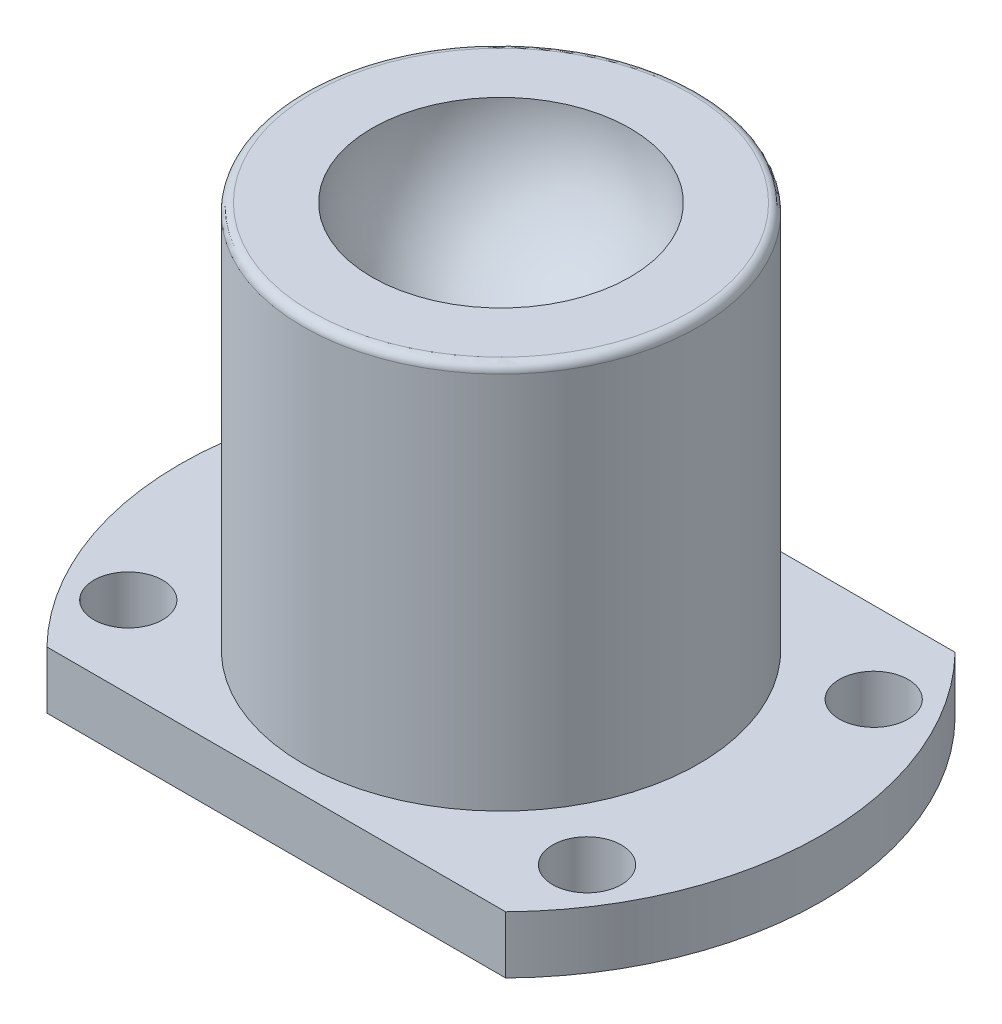
from build123d import *

# Parameters (mm, degrees)
SKETCH_1_R          = 11.2
EXTRUDE_1_DEPTH     = 2
SKETCH_2_OUTSIDE_W  = 30.748
SKETCH_2_OUTSIDE_H  = 30.748
CUT_EXTRUDE_1_DEPTH = 2
SKETCH_3_R          = 6.9
EXTRUDE_2_DEPTH     = 13.5
SKETCH_4_R          = 1.2
CUT_EXTRUDE_2_DEPTH = 13.5
FILLET_1_R          = 0.3


with BuildPart() as part:
    # 草图1 → 凸台-拉伸1 (new body)
    with BuildSketch(Plane(origin=(0, 0, 0), x_dir=(1, 0, 0), z_dir=(0, 1, 0))):
        with Locations(Location((0, 0, 0), (0, 0, 270))):
            Circle(SKETCH_1_R)
    extrude(amount=EXTRUDE_1_DEPTH)

    # 草图2 outside → 切除-拉伸1 (cut)
    with BuildSketch(Plane(origin=(0, 2, 0), x_dir=(1, 0, 0), z_dir=(0, 1, 0))):
        Rectangle(SKETCH_2_OUTSIDE_W, SKETCH_2_OUTSIDE_H)
        with BuildLine():
            Line((-8, -7.838367177), (8, -7.838367177))
            ThreePointArc((8, -7.838367177), (11.2, 0), (8, 7.838367177))
            Line((8, 7.838367177), (-8, 7.838367177))
            ThreePointArc((-8, 7.838367177), (-11.2, 0), (-8, -7.838367177))
        make_face(mode=Mode.SUBTRACT)
    extrude(amount=-CUT_EXTRUDE_1_DEPTH, mode=Mode.SUBTRACT)

    # 草图3 → 凸台-拉伸2 (add)
    with BuildSketch(Plane(origin=(0, 2, 0), x_dir=(1, 0, 0), z_dir=(0, 1, 0))):
        with Locations(Location((0, 0, 0), (0, 0, 270))):
            Circle(SKETCH_3_R)
    extrude(amount=EXTRUDE_2_DEPTH)

    # 草图4 → 切除-拉伸2 (cut)
    with BuildSketch(Plane(origin=(0, 2, 0), x_dir=(1, 0, 0), z_dir=(0, 1, 0))):
        with Locations(Location((-8, 5, 0), (0, 0, 270))):
            Circle(SKETCH_4_R)
        with Locations(Location((-8, -5, 0), (0, 0, 270))):
            Circle(SKETCH_4_R)
        with Locations(Location((8, -5, 0), (0, 0, 270))):
            Circle(SKETCH_4_R)
        with Locations(Location((8, 5, 0), (0, 0, 270))):
            Circle(SKETCH_4_R)
    extrude(amount=-CUT_EXTRUDE_2_DEPTH, mode=Mode.SUBTRACT)

    # 圆角1
    fillet_1_edges = [part.edges().sort_by_distance(p)[0] for p in [
        (0, 15.5, -6.9),
    ]]
    fillet(fillet_1_edges, radius=FILLET_1_R)

    # 草图5 → 切除-旋转1 (revolve, cut)
    with BuildSketch(Plane(origin=(0, 15.5, 0), x_dir=(1, 0, 0), z_dir=(0, 1, 0))):
        with BuildLine():
            Line((0, 4.5), (0, -4.5))
            ThreePointArc((0, -4.5), (4.5, 0), (0, 4.5))
        make_face()
    revolve(axis=Axis((0, 15.5, 4.5), (0, 0, -1)), mode=Mode.SUBTRACT)


solid = part.part
